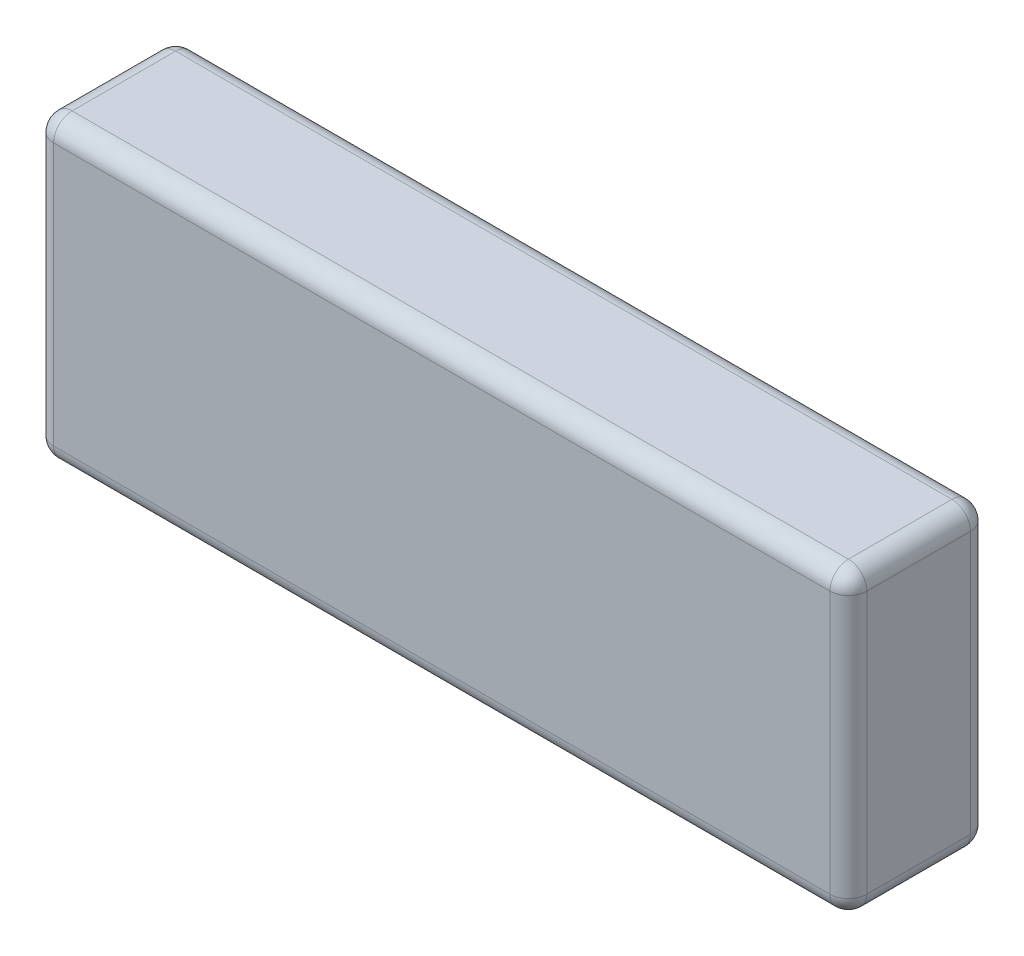
from build123d import *

# Parameters (mm, degrees)
SKETCH1_W           = 22
SKETCH1_H           = 8.1
BOSS_EXTRUDE1_DEPTH = 3.8
FILLET1_R           = 0.5


with BuildPart() as part:
    # Sketch1 → Boss-Extrude1 (new body)
    with BuildSketch(Plane.XY):
        with Locations((11, 4.05)):
            Rectangle(SKETCH1_W, SKETCH1_H)
    extrude(amount=BOSS_EXTRUDE1_DEPTH)

    # Fillet1
    fillet1_edges = [part.edges().sort_by_distance(p)[0] for p in [
        (22, 4.05, 3.8),
        (11, 8.1, 3.8),
        (0, 4.05, 3.8),
        (11, 8.1, 0),
        (22, 4.05, 0),
        (11, 0, 0),
        (0, 4.05, 0),
        (11, 0, 3.8),
        (0, 8.1, 1.9),
        (22, 8.1, 1.9),
        (22, 0, 1.9),
        (0, 0, 1.9),
    ]]
    fillet(fillet1_edges, radius=FILLET1_R)


solid = part.part
